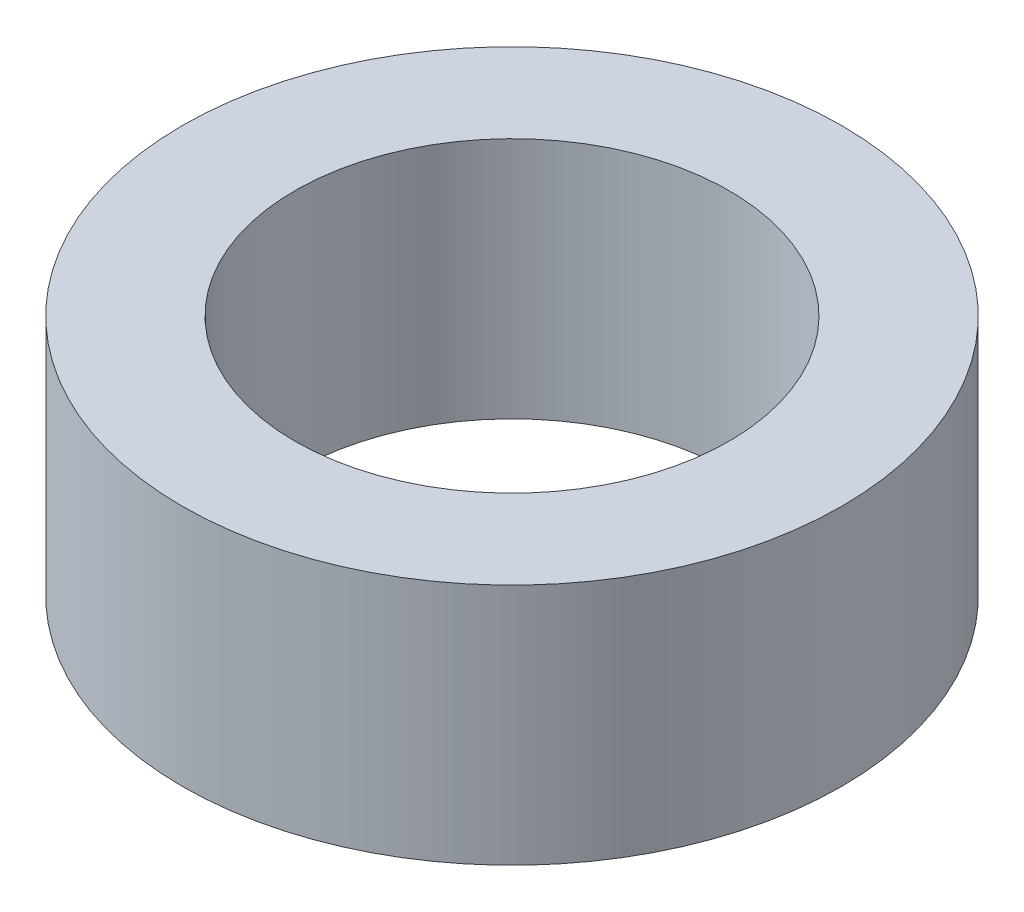
from build123d import *

# Parameters (mm, degrees)
SKETCH1_R           = 6.075
SKETCH1_R_2         = 4
BOSS_EXTRUDE1_DEPTH = 4.4704


with BuildPart() as part:
    # Sketch1 → Boss-Extrude1 (new body)
    with BuildSketch(Plane(origin=(0, 0, 0), x_dir=(1, 0, 0), z_dir=(0, 1, 0))):
        with Locations(Location((0, 0, 0), (0, 0, 270))):
            Circle(SKETCH1_R)
        with Locations(Location((0, 0, 0), (0, 0, 270))):
            Circle(SKETCH1_R_2, mode=Mode.SUBTRACT)
    extrude(amount=BOSS_EXTRUDE1_DEPTH)


solid = part.part
